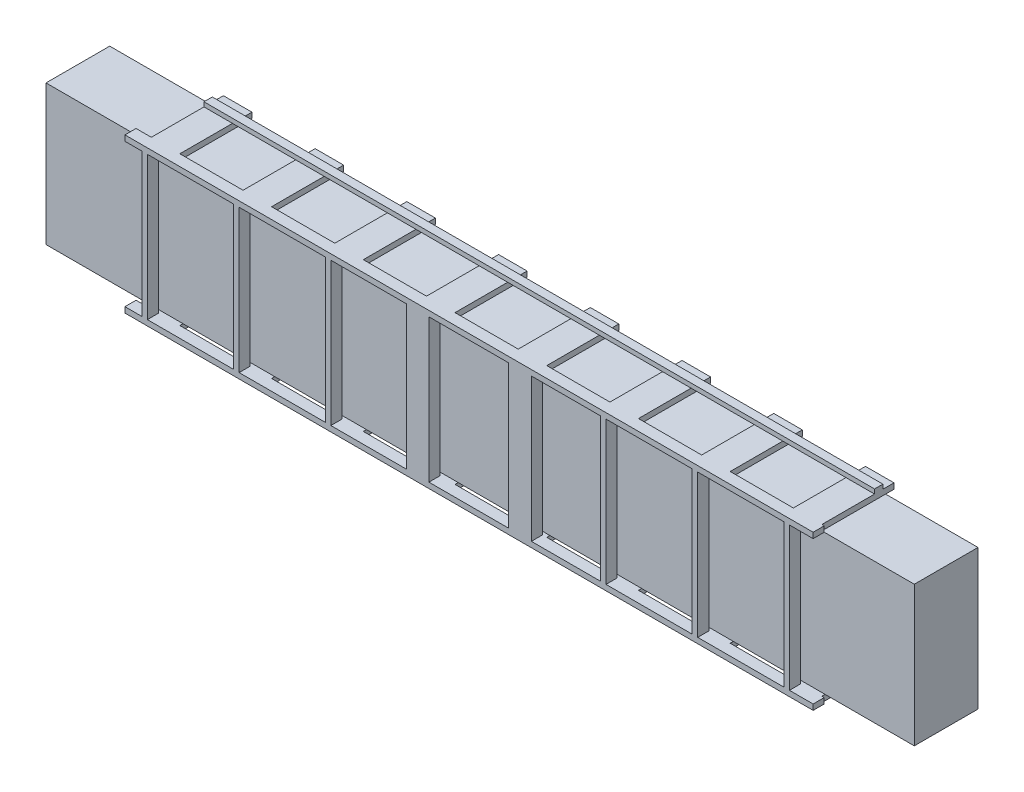
from build123d import *

# Parameters (mm, degrees)
SKETCH1_W             = 6190
SKETCH1_H             = 50
BOSS_EXTRUDE1_DEPTH   = 100
BOSS_EXTRUDE1_2_DEPTH = 100
SKETCH2_W             = 200
SKETCH2_H             = 100
BOSS_EXTRUDE2_DEPTH   = 1388
SKETCH4_W             = 50
SKETCH4_H             = 100
BOSS_EXTRUDE3_DEPTH   = 1288
SKETCH5_W             = 256.6
SKETCH5_H             = 50
BOSS_EXTRUDE4_DEPTH   = 648.4
BOSS_EXTRUDE12_REACH  = 6358.377
SKETCH13_W            = 75
SKETCH13_H            = 40
SKETCH11_W            = 572.975396728
SKETCH11_H            = 1259.313187421
BOSS_EXTRUDE10_DEPTH  = 7000
SKETCH12_W            = 572.975396728
SKETCH12_H            = 1259.313187421
BOSS_EXTRUDE11_DEPTH  = 810


with BuildPart() as part:
    # Sketch1 → Boss-Extrude1 (new body)
    with BuildSketch(Plane.XY):
        with Locations((3095, 1363)):
            Rectangle(SKETCH1_W, SKETCH1_H)
    extrude(amount=BOSS_EXTRUDE1_DEPTH)



with BuildPart() as body_2:
    # Sketch1 → Boss-Extrude1 2 (new body)
    with BuildSketch(Plane.XY):
        with Locations((3095, 25)):
            Rectangle(SKETCH1_W, SKETCH1_H)
    extrude(amount=BOSS_EXTRUDE1_2_DEPTH)


with BuildPart() as part_1:
    add(part.part)

    add(body_2.part)  # Boss-Extrude2 merges body 2
    # Sketch2 → Boss-Extrude2 (add)
    with BuildSketch(Plane.XZ):
        with Locations((2634, 50)):
            Rectangle(SKETCH2_W, SKETCH2_H)
        with Locations((3556, 50)):
            Rectangle(SKETCH2_W, SKETCH2_H)
    extrude(amount=-BOSS_EXTRUDE2_DEPTH)

    # Sketch4 → Boss-Extrude3 (add)
    with BuildSketch(Plane(origin=(0, 50, 0), x_dir=(1, 0, 0), z_dir=(0, 1, 0))):
        with Locations((177, -50)):
            Rectangle(SKETCH4_W, SKETCH4_H)
        with Locations((1002, -50)):
            Rectangle(SKETCH4_W, SKETCH4_H)
        with Locations((1827, -50)):
            Rectangle(SKETCH4_W, SKETCH4_H)
        with Locations((2652, -50)):
            Rectangle(SKETCH4_W, SKETCH4_H)
        with Locations((3477, -50)):
            Rectangle(SKETCH4_W, SKETCH4_H)
        with Locations((4302, -50)):
            Rectangle(SKETCH4_W, SKETCH4_H)
        with Locations((5127, -50)):
            Rectangle(SKETCH4_W, SKETCH4_H)
        with Locations((5952, -50)):
            Rectangle(SKETCH4_W, SKETCH4_H)
    extrude(amount=BOSS_EXTRUDE3_DEPTH)

    # Sketch5 → Boss-Extrude4 (add)
    with BuildSketch(Plane.XY):
        with Locations((6040.7, 1363)):
            Rectangle(SKETCH5_W, SKETCH5_H)
        with Locations((265.7, 1363)):
            Rectangle(SKETCH5_W, SKETCH5_H)
        with Locations((265.7, 25)):
            Rectangle(SKETCH5_W, SKETCH5_H)
        with Locations((6040.7, 25)):
            Rectangle(SKETCH5_W, SKETCH5_H)
        with Locations((5215.7, 25)):
            Rectangle(SKETCH5_W, SKETCH5_H)
        with Locations((1090.7, 1363)):
            Rectangle(SKETCH5_W, SKETCH5_H)
        with Locations((4390.7, 25)):
            Rectangle(SKETCH5_W, SKETCH5_H)
        with Locations((1915.7, 1363)):
            Rectangle(SKETCH5_W, SKETCH5_H)
        with Locations((3565.7, 25)):
            Rectangle(SKETCH5_W, SKETCH5_H)
        with Locations((2740.7, 1363)):
            Rectangle(SKETCH5_W, SKETCH5_H)
        with Locations((2740.7, 25)):
            Rectangle(SKETCH5_W, SKETCH5_H)
        with Locations((3565.7, 1363)):
            Rectangle(SKETCH5_W, SKETCH5_H)
        with Locations((1915.7, 25)):
            Rectangle(SKETCH5_W, SKETCH5_H)
        with Locations((1090.7, 25)):
            Rectangle(SKETCH5_W, SKETCH5_H)
        with Locations((4390.7, 1363)):
            Rectangle(SKETCH5_W, SKETCH5_H)
        with Locations((5215.7, 1363)):
            Rectangle(SKETCH5_W, SKETCH5_H)
    extrude(amount=-BOSS_EXTRUDE4_DEPTH)

    # Boss-Extrude12: up to this face of the body (flat: up to its plane)
    boss_extrude12_end = Plane(part_1.part.faces().sort_by_distance((137.4, 1363, -324.2))[0])
    # Sketch13 → Boss-Extrude12 (add, up to the picked face)
    with BuildSketch(Plane(origin=(6169, 0, 0), x_dir=(0, 0, -1), z_dir=(1, 0, 0)), mode=Mode.PRIVATE) as boss_extrude12_sk1:
        with Locations((510.9, -20)):
            Rectangle(SKETCH13_W, SKETCH13_H)
    boss_extrude12_tool1 = split(extrude(boss_extrude12_sk1.sketch, amount=-BOSS_EXTRUDE12_REACH, mode=Mode.PRIVATE), bisect_by=boss_extrude12_end, keep=Keep.BOTH, mode=Mode.PRIVATE)
    # Sketch13 → Boss-Extrude12 (add, up to the picked face)
    with BuildSketch(Plane(origin=(6169, 0, 0), x_dir=(0, 0, -1), z_dir=(1, 0, 0)), mode=Mode.PRIVATE) as boss_extrude12_sk2:
        with Locations((510.9, 1408)):
            Rectangle(SKETCH13_W, SKETCH13_H)
    boss_extrude12_tool2 = split(extrude(boss_extrude12_sk2.sketch, amount=-BOSS_EXTRUDE12_REACH, mode=Mode.PRIVATE), bisect_by=boss_extrude12_end, keep=Keep.BOTH, mode=Mode.PRIVATE)
    add(boss_extrude12_tool1.solids().sort_by(Axis((6169, -20, -510.9), (-1, 0, 0)))[0])
    add(boss_extrude12_tool2.solids().sort_by(Axis((6169, 1408, -510.9), (-1, 0, 0)))[0])


with BuildPart() as body_2_2:
    # Sketch11 → Boss-Extrude10 (new body)
    with BuildSketch(Plane(origin=(0, 0, 0), x_dir=(0, 0, -1), z_dir=(1, 0, 0))):
        with Locations((286.487698364, 708.343406289)):
            Rectangle(SKETCH11_W, SKETCH11_H)
    extrude(amount=BOSS_EXTRUDE10_DEPTH)

    # Sketch12 → Boss-Extrude11 (add)
    with BuildSketch(Plane.ZY):
        with Locations((-286.487698364, 708.343406289)):
            Rectangle(SKETCH12_W, SKETCH12_H)
    extrude(amount=BOSS_EXTRUDE11_DEPTH)


solid = Compound([part_1.part, body_2_2.part])
